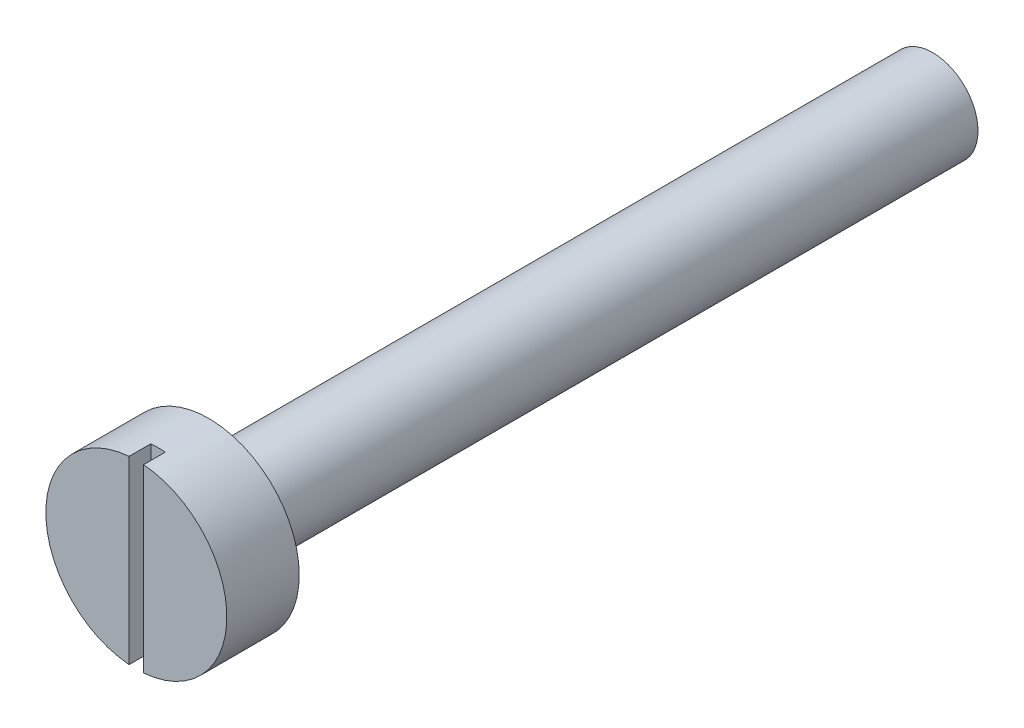
from build123d import *

# Parameters (mm, degrees)
EXTRUDE_1_DEPTH      = 35
EXTRUDE_1_DEPTH_BACK = 5
SKETCH_1_R           = 2.5
SKETCH_2_R           = 5
EXTRUDE_2_DEPTH      = 4
SKETCH_3_W           = 0.8
SKETCH_3_H           = 11.021006482
CUT_EXTRUDE_1_DEPTH  = 1.2


with BuildPart() as part:
    # Эскиз1 → Вытянуть1 (new, two sides: drawn at the far end of the back side and taken through both)
    with BuildSketch(Plane.XY.offset(-EXTRUDE_1_DEPTH_BACK)):
        Circle(SKETCH_1_R)
    extrude(amount=EXTRUDE_1_DEPTH + EXTRUDE_1_DEPTH_BACK)

    # Эскиз2 → Вытянуть2 (add)
    with BuildSketch(Plane.XY.offset(35)):
        Circle(SKETCH_2_R)
    extrude(amount=EXTRUDE_2_DEPTH)

    # Эскиз3 → Вырез-Вытянуть1 (cut)
    with BuildSketch(Plane.XY.offset(39)):
        with Locations((0, 0.044379892)):
            Rectangle(SKETCH_3_W, SKETCH_3_H)
    extrude(amount=-CUT_EXTRUDE_1_DEPTH, mode=Mode.SUBTRACT)


solid = part.part
